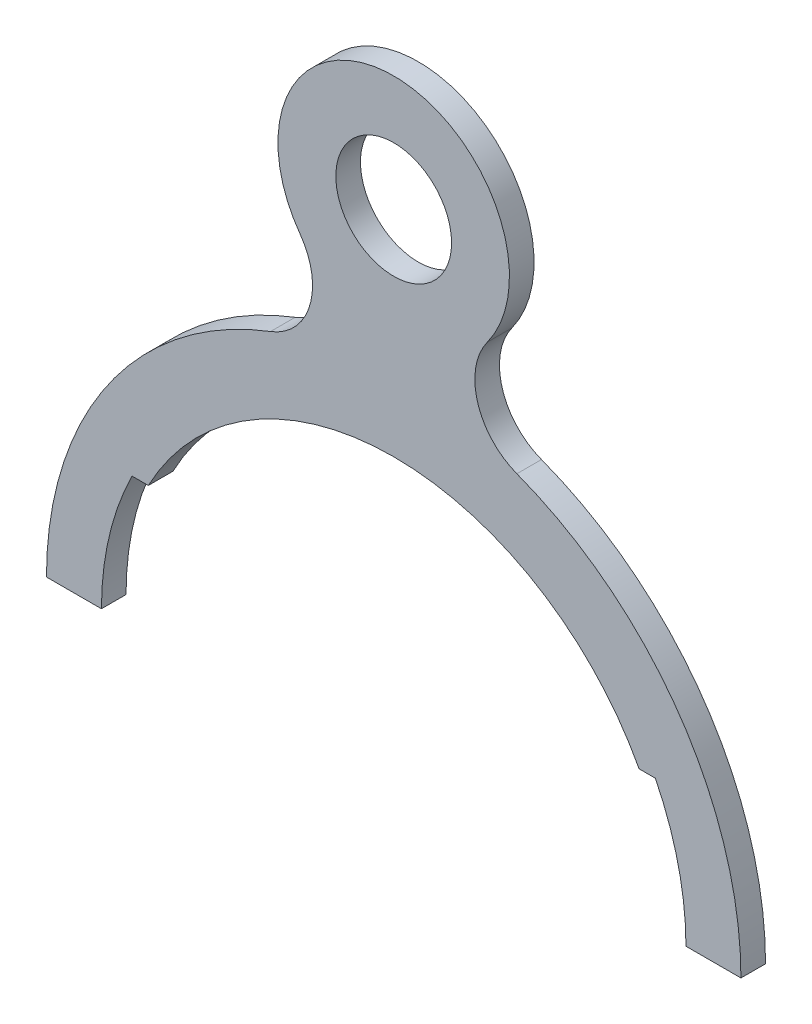
from build123d import *
from build123d.topology import SkipClean

# Parameters (mm, degrees)
SKETCH_1_R             = 20
EXTRUDE_1_DEPTH        = 8.5
HOLE_WIZARD_M4_1_D     = 3.3
HOLE_WIZARD_M4_1_DEPTH = 10.1
HOLE_WIZARD_M4_1_TIP   = 0.991420021
CUT_EXTRUDE_START      = -10
CUT_EXTRUDE_1_DEPTH    = 10


with BuildPart() as part:
    # 草图1 → 凸台-拉伸1 (new body)
    with BuildSketch(Plane.XY):
        with BuildLine():
            Line((-40, 170), (-40, 169.705627485))
            ThreePointArc((-40, 169.705627485), (-49.546596627, 127.065484214), (-76.363636364, 92.566705901))
            ThreePointArc((-76.363636364, 92.566705901), (-108.544084048, 51.168171925), (-120, 0))
            Line((-120, 0), (-101, 0))
            ThreePointArc((-101, 0), (-98.319745933, 23.113363226), (-90.421236444, 45))
            Line((-90.421236444, 45), (-84.799764151, 45))
            ThreePointArc((-84.799764151, 45), (0, 96), (84.799764151, 45))
            Line((84.799764151, 45), (90.421236444, 45))
            ThreePointArc((90.421236444, 45), (98.319745933, 23.113363226), (101, 0))
            Line((101, 0), (120, 0))
            ThreePointArc((120, 0), (108.544084048, 51.168171925), (76.363636364, 92.566705901))
            ThreePointArc((76.363636364, 92.566705901), (49.546596627, 127.065484214), (40, 169.705627485))
            Line((40, 169.705627485), (40, 170))
            ThreePointArc((40, 170), (0, 210), (-40, 170))
        make_face()
        with Locations((0, 170)):
            Circle(SKETCH_1_R, mode=Mode.SUBTRACT)
    extrude(amount=EXTRUDE_1_DEPTH)

    # M4 螺纹孔1
    with Locations(Plane(origin=(-115, 0, 4.25), x_dir=(0, 0, -1), z_dir=(0, -1, 0))):
        with Locations((0, 0), (0, 230)):
            Hole(HOLE_WIZARD_M4_1_D / 2, depth=HOLE_WIZARD_M4_1_DEPTH)
            with Locations((0, 0, -(HOLE_WIZARD_M4_1_DEPTH + HOLE_WIZARD_M4_1_TIP / 2))):  # 118° drill point
                Cone(0, HOLE_WIZARD_M4_1_D / 2, HOLE_WIZARD_M4_1_TIP, mode=Mode.SUBTRACT)

    # 草图5 → 切除-拉伸1 (cut)
    with SkipClean():  # the faces are left unmerged after this step: merging them gives an invalid solid
        with BuildSketch(Plane.XY.offset(8.5).offset(CUT_EXTRUDE_START)):
            with BuildLine():
                Line((-40, 170), (-40, 169.705627485))
                ThreePointArc((-40, 169.705627485), (-49.546596627, 127.065484214), (-76.363636364, 92.566705901))
                ThreePointArc((-76.363636364, 92.566705901), (-60.26783628, 103.76795223), (-42.562622554, 112.198142415))
                ThreePointArc((-42.562622554, 112.198142415), (-28.980506646, 126.808479049), (-32.347593141, 146.470588235))
                ThreePointArc((-32.347593141, 146.470588235), (-38.038820471, 157.628737446), (-40, 170))
            make_face()
        cut_extrude_1 = extrude(amount=CUT_EXTRUDE_1_DEPTH, mode=Mode.SUBTRACT)

    # 镜向1: 切除-拉伸1 across plane
    with SkipClean():  # the faces are left unmerged after this step: merging them gives an invalid solid
        add(cut_extrude_1.mirror(Plane(origin=(0, 0, 0), x_dir=(0, 0, 1), z_dir=(1, 0, 0))), mode=Mode.SUBTRACT)


solid = part.part
